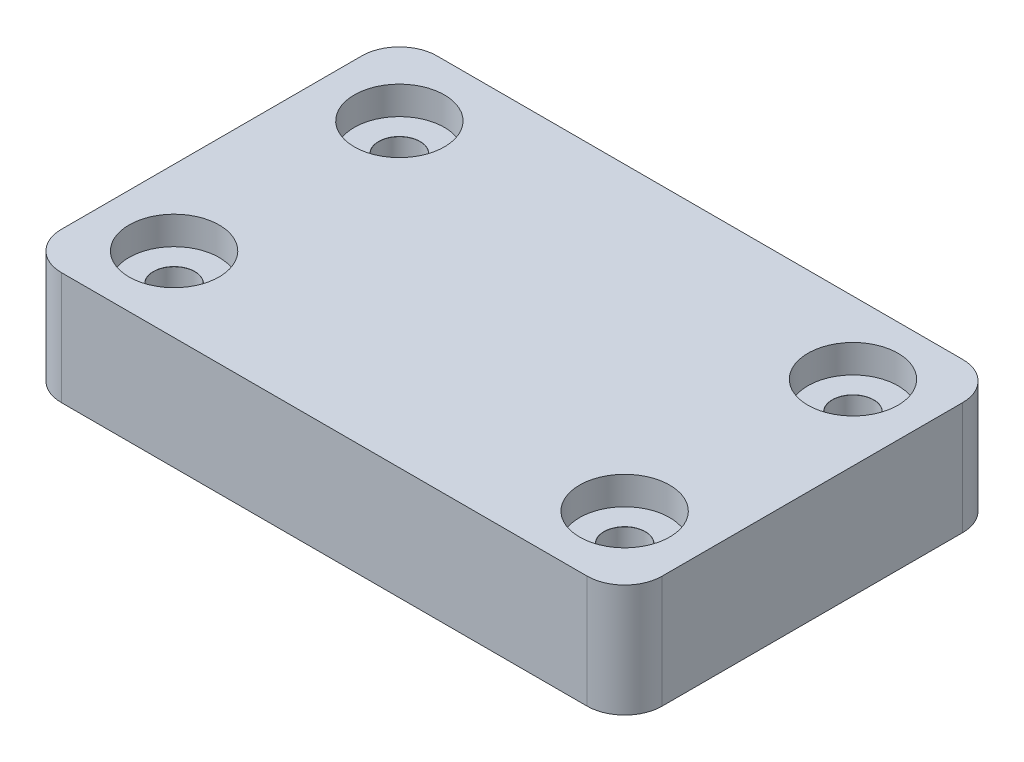
from build123d import *

# Parameters (mm, degrees)
SALIENTE_EXTRUIR1_DEPTH                     = 30
REFRENTADO_PARA_TORNILLO_CON_CABEZA_2_COUNT = 2
REFRENTADO_PARA_TORNILLO_CON_CABEZA_2_PITCH = 120.002783684
REFRENTADO_PARA_TORNILLO_CON_CABEZA_3_COUNT = 2
REFRENTADO_PARA_TORNILLO_CON_CABEZA_3_PITCH = 60
REFRENTADO_PARA_TORNILLO_CON_CABEZA_4_COUNT = 2
REFRENTADO_PARA_TORNILLO_CON_CABEZA_4_PITCH = 134.16407865


with BuildPart() as part:
    # Croquis1 → Saliente-Extruir1 (new body)
    with BuildSketch(Plane(origin=(0, 0, 0), x_dir=(1, 0, 0), z_dir=(0, 1, 0))):
        with BuildLine():
            Line((-70, -50), (70, -50))
            ThreePointArc((70, -50), (77.071067812, -47.071067812), (80, -40))
            Line((80, -40), (80, 40))
            ThreePointArc((80, 40), (77.071067812, 47.071067812), (70, 50))
            Line((70, 50), (-70, 50))
            ThreePointArc((-70, 50), (-77.071067812, 47.071067812), (-80, 40))
            Line((-80, 40), (-80, -40))
            ThreePointArc((-80, -40), (-77.071067812, -47.071067812), (-70, -50))
        make_face()
    extrude(amount=SALIENTE_EXTRUIR1_DEPTH)

    # Croquis5 → Refrentado para tornillo con cabeza troncocónica de M101 (revolve, cut)
    with BuildSketch(Plane(origin=(-60, 30, -30), x_dir=(0, 0, 1), z_dir=(1, 0, 0))):
        Polygon((0, 0), (0, 30), (5.525, 30), (5.5, 29.975), (5.5, 7.525), (5.525, 7.5), (12, 7.5), (12, 0), align=None)
    refrentado_para_tornillo_con_cabeza_tron = revolve(axis=Axis((-60, 36.35, -30), (0, -1, 0)), mode=Mode.SUBTRACT)

    # Refrentado para tornillo con cabeza  2: Refrentado para tornillo con cabeza troncocónica de M101 ×2
    with Locations(*[Vector(0.9999768031686442, 0, -0.006811249857308006) * (i * REFRENTADO_PARA_TORNILLO_CON_CABEZA_2_PITCH) for i in range(1, REFRENTADO_PARA_TORNILLO_CON_CABEZA_2_COUNT)]):
        add(refrentado_para_tornillo_con_cabeza_tron, mode=Mode.SUBTRACT)

    # Refrentado para tornillo con cabeza  3: Refrentado para tornillo con cabeza troncocónica de M101 ×2
    with Locations(*[(0, 0, i * REFRENTADO_PARA_TORNILLO_CON_CABEZA_3_PITCH) for i in range(1, REFRENTADO_PARA_TORNILLO_CON_CABEZA_3_COUNT)]):
        add(refrentado_para_tornillo_con_cabeza_tron, mode=Mode.SUBTRACT)

    # Refrentado para tornillo con cabeza  4: Refrentado para tornillo con cabeza troncocónica de M101 ×2
    with Locations(*[Vector(0.894427190999916, 0, 0.447213595499958) * (i * REFRENTADO_PARA_TORNILLO_CON_CABEZA_4_PITCH) for i in range(1, REFRENTADO_PARA_TORNILLO_CON_CABEZA_4_COUNT)]):
        add(refrentado_para_tornillo_con_cabeza_tron, mode=Mode.SUBTRACT)


solid = part.part
